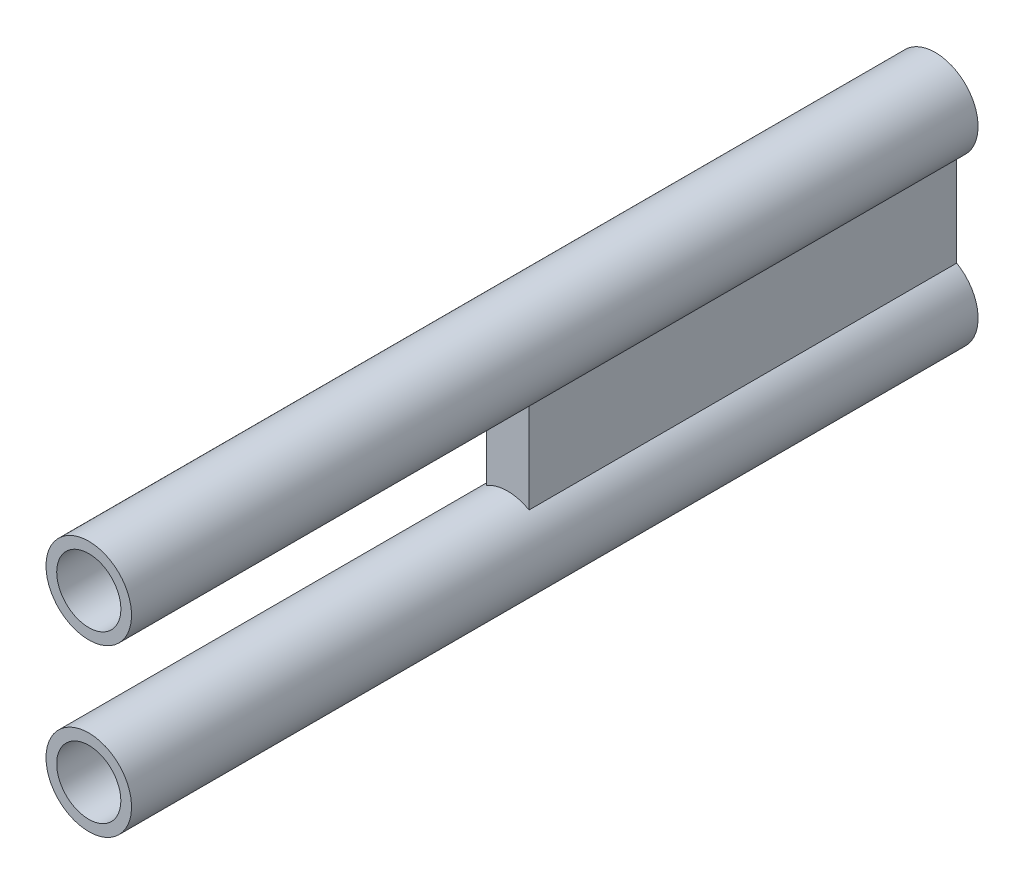
from build123d import *

# Parameters (mm, degrees)
ESQUISSE1_R          = 2
ESQUISSE1_R_2        = 1.5
BOSS_EXTRU_1_DEPTH   = 39.58852
BOSS_EXTRU_1_2_DEPTH = 39.58852
BOSS_EXTRU_2_DEPTH   = 20


with BuildPart() as part:
    # Esquisse1 → Boss.-Extru.1 (new body)
    with BuildSketch(Plane.XY):
        with Locations(Location((0, 3.882050808, 0), (0, 0, 180))):
            Circle(ESQUISSE1_R)
        with Locations(Location((0, 3.882050808, 0), (0, 0, 180))):
            Circle(ESQUISSE1_R_2, mode=Mode.SUBTRACT)
    extrude(amount=BOSS_EXTRU_1_DEPTH)



with BuildPart() as body_2:
    # Esquisse1 → Boss.-Extru.1 2 (new body)
    with BuildSketch(Plane.XY):
        with Locations(Location((0, -3.882050808, 0), (0, 0, 180))):
            Circle(ESQUISSE1_R)
        with Locations((0, -3.882050808)):
            Circle(ESQUISSE1_R_2, mode=Mode.SUBTRACT)
    extrude(amount=BOSS_EXTRU_1_2_DEPTH)


with BuildPart() as part_1:
    add(part.part)

    add(body_2.part)  # Boss.-Extru.2 merges body 2
    # Esquisse1<3> → Boss.-Extru.2 (add)
    with BuildSketch(Plane.XY):
        with BuildLine():
            ThreePointArc((-1, -2.15), (0, -1.882050808), (1, -2.15))
            Line((1, -2.15), (1, 2.15))
            ThreePointArc((1, 2.15), (0, 1.882050808), (-1, 2.15))
            Line((-1, 2.15), (-1, -2.15))
        make_face()
    extrude(amount=BOSS_EXTRU_2_DEPTH)


solid = part_1.part
